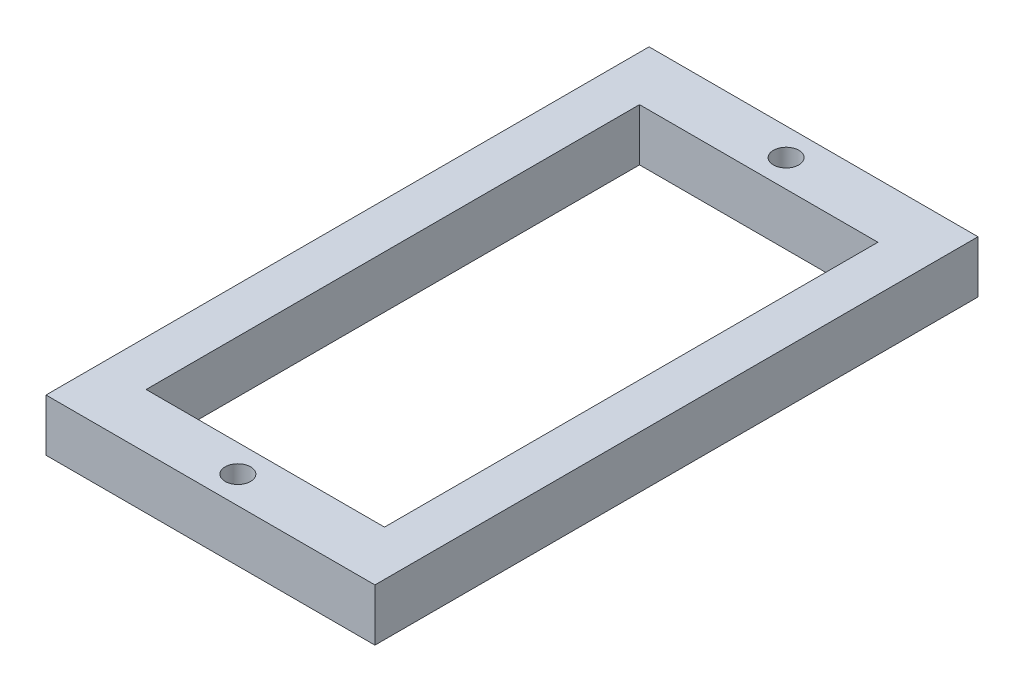
from build123d import *

# Parameters (mm, degrees)
SKETCH2_W           = 38.1
SKETCH2_H           = 69.85
SKETCH2_R           = 1.4732
SKETCH2_W_2         = 27.6098
SKETCH2_H_2         = 57.15
BOSS_EXTRUDE1_DEPTH = 6.0452


with BuildPart() as part:
    # Sketch2 → Boss-Extrude1 (new body)
    with BuildSketch(Plane(origin=(0, 0, 0), x_dir=(1, 0, 0), z_dir=(0, 1, 0))):
        with Locations((-7.173243467, 10.249774524)):
            Rectangle(SKETCH2_W, SKETCH2_H)
        with Locations(Location((-7.173243467, 41.999774524, 0), (0, 0, 90))):
            Circle(SKETCH2_R, mode=Mode.SUBTRACT)
        with Locations(Location((-7.173243467, -21.500225476, 0), (0, 0, 270))):
            Circle(SKETCH2_R, mode=Mode.SUBTRACT)
        with Locations((-7.173243467, 10.249774524)):
            Rectangle(SKETCH2_W_2, SKETCH2_H_2, mode=Mode.SUBTRACT)
    extrude(amount=BOSS_EXTRUDE1_DEPTH)


solid = part.part
